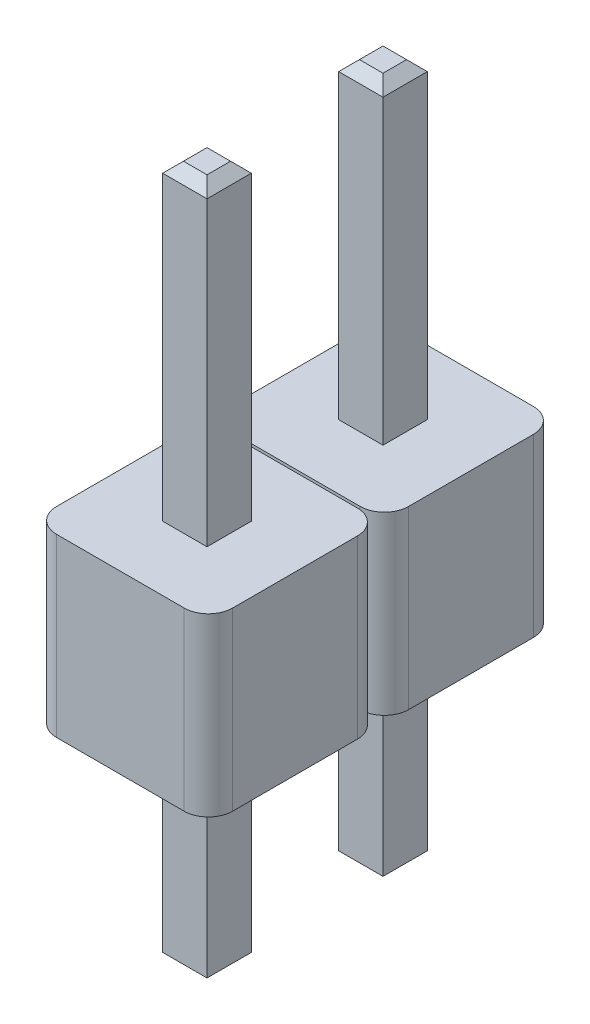
from build123d import *

# Parameters (mm, degrees)
SKETCH1_W           = 0.64
SKETCH1_H           = 0.64
BOSS_EXTRUDE1_DEPTH = 10.04
CHAMFER1_SIZE       = 0.15
BOSS_EXTRUDE2_DEPTH = 2.54
LPATTERN2_COUNT     = 2
LPATTERN2_PITCH     = 2.54


with BuildPart() as part:
    # Sketch1 → Boss-Extrude1 (new body)
    with BuildSketch(Plane(origin=(0, 0, 0), x_dir=(1, 0, 0), z_dir=(0, 1, 0))):
        with Locations((0.32, 0.32)):
            Rectangle(SKETCH1_W, SKETCH1_H)
    extrude(amount=BOSS_EXTRUDE1_DEPTH)

    # Chamfer1
    chamfer1_edges = [part.edges().sort_by_distance(p)[0] for p in [
        (0.64, 10.04, -0.32),
        (0.32, 10.04, -0.64),
        (0, 10.04, -0.32),
        (0.32, 0, -0.64),
        (0.64, 0, -0.32),
        (0.32, 0, 0),
        (0, 0, -0.32),
        (0.32, 10.04, 0),
    ]]
    chamfer(chamfer1_edges, length=CHAMFER1_SIZE)

    # Sketch3 → Boss-Extrude2 (add)
    with BuildSketch(Plane(origin=(0, 5.54, 0), x_dir=(1, 0, 0), z_dir=(0, 1, 0))):
        with BuildLine():
            Line((-0.6, -0.93), (1.24, -0.93))
            ThreePointArc((1.24, -0.93), (1.487487373, -0.827487373), (1.59, -0.58))
            Line((1.59, -0.58), (1.59, 1.22))
            ThreePointArc((1.59, 1.22), (1.487487373, 1.467487373), (1.24, 1.57))
            Line((1.24, 1.57), (-0.6, 1.57))
            ThreePointArc((-0.6, 1.57), (-0.847487373, 1.467487373), (-0.95, 1.22))
            Line((-0.95, 1.22), (-0.95, -0.58))
            ThreePointArc((-0.95, -0.58), (-0.847487373, -0.827487373), (-0.6, -0.93))
        make_face()
    extrude(amount=-BOSS_EXTRUDE2_DEPTH)


with BuildPart() as lpattern2_1:
    # LPattern2: pattern copy
    add(part.part.moved(Location(Vector(0, 0, -1) * (1 * LPATTERN2_PITCH))))


solid = Compound([part.part, lpattern2_1.part])
